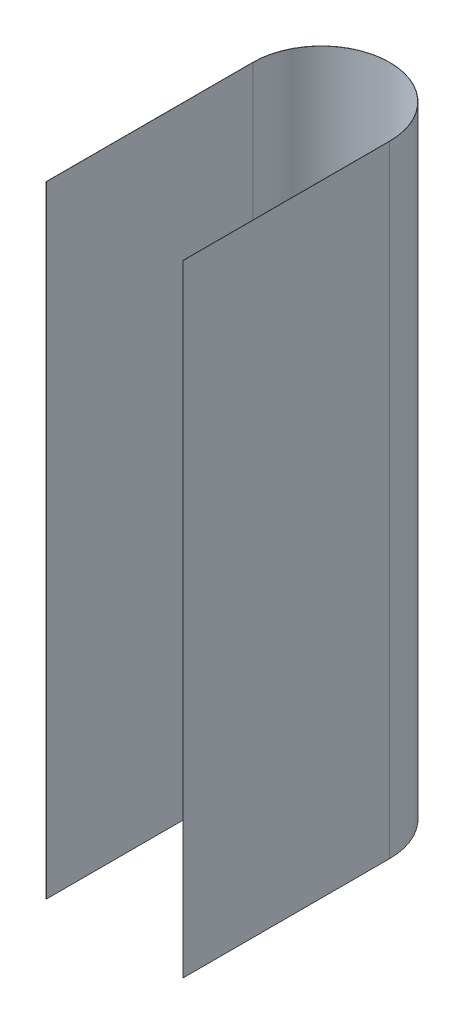
from build123d import *

# Parameters (mm, degrees)
BOSS_EXTRUDE1_DEPTH = 300.5


with BuildPart() as part:
    # Sketch1 → Boss-Extrude1 (new body)
    with BuildSketch(Plane(origin=(0, 0, 0), x_dir=(1, 0, 0), z_dir=(0, 1, 0))):
        with BuildLine():
            Line((0, 0), (0, -100))
            Line((0, -100), (-0.1, -100))
            Line((-0.1, -100), (-0.1, 0))
            ThreePointArc((-0.1, 0), (33, 33.1), (66.1, 0))
            Line((66.1, 0), (66.1, -100))
            Line((66.1, -100), (66, -100))
            Line((66, -100), (66, 0))
            ThreePointArc((66, 0), (33, 33), (0, 0))
        make_face()
    extrude(amount=BOSS_EXTRUDE1_DEPTH)


solid = part.part
